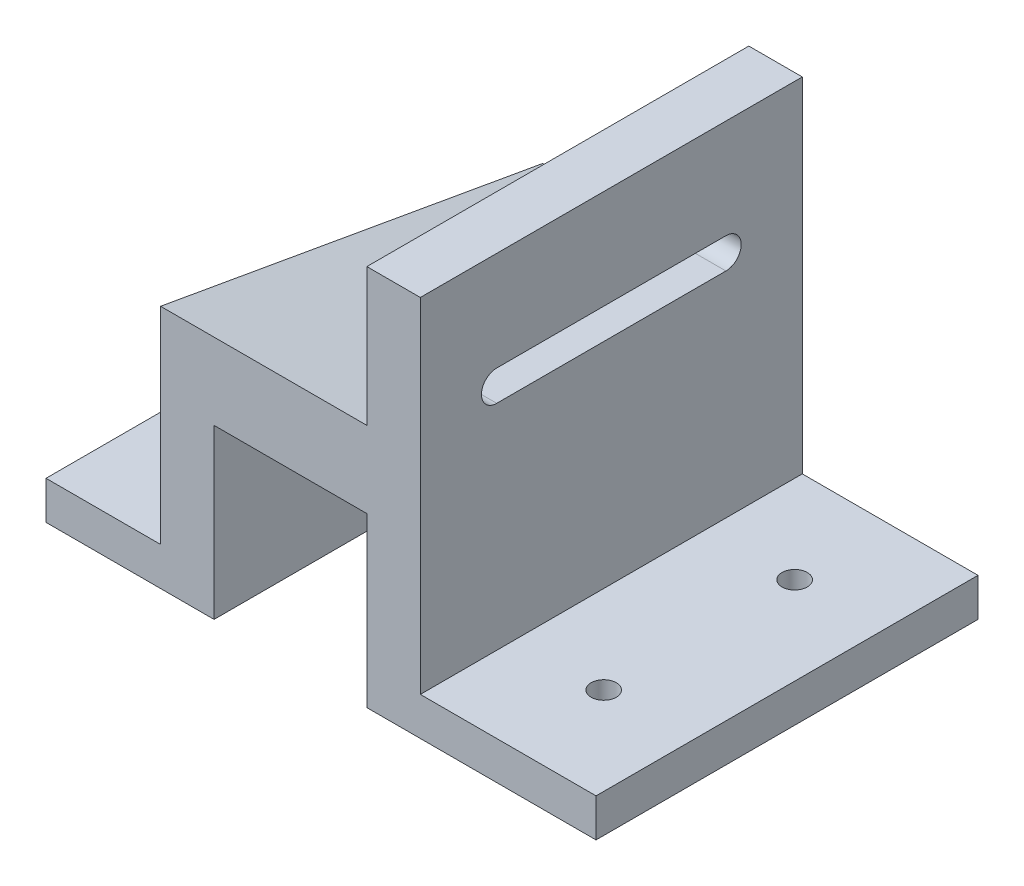
from build123d import *

# Parameters (mm, degrees)
RESSALTO_EXTRUS_O1_DEPTH = 50
CORTE_EXTRUS_O1_DEPTH    = 50
ESBO_O5_R                = 1.65
CORTE_EXTRUS_O2_DEPTH    = 10
ESBO_O7_W                = 27
ESBO_O7_H                = 9.386843201
ESBO_O7_W_2              = 20
ESBO_O7_H_2              = 15
CORTE_EXTRUS_O3_DEPTH    = 84.527706575
ESBO_O8_R                = 4.15
CORTE_EXTRUS_O4_DEPTH    = 77.677309979


with BuildPart() as part:
    # Esboço2 → Ressalto-extrusão1 (new body)
    with BuildSketch(Plane.XY):
        Polygon((0, 0), (30, 0), (30, 5), (7, 5), (7, 50), (0, 50), (0, 32), (-20, 32), (-27, 32), (-27, 5), (-42, 5), (-42, 0), (-20, 0), (-20, 7), (0, 7), align=None)
    extrude(amount=RESSALTO_EXTRUS_O1_DEPTH)

    # Esboço3 → Corte-extrusão1 (cut)
    with BuildSketch(Plane(origin=(7, 0, 0), x_dir=(0, 0, -1), z_dir=(1, 0, 0))):
        with BuildLine():
            Line((-40, 33), (-10, 33))
            ThreePointArc((-10, 33), (-8, 35), (-10, 37))
            Line((-10, 37), (-40, 37))
            ThreePointArc((-40, 37), (-42, 35), (-40, 33))
        make_face()
    extrude(amount=-CORTE_EXTRUS_O1_DEPTH, mode=Mode.SUBTRACT)

    # Esboço5 → Corte-extrusão2 (cut)
    with BuildSketch(Plane(origin=(0, 5, 0), x_dir=(1, 0, 0), z_dir=(0, 1, 0))):
        with Locations(Location((18.5, -37.5, 0), (0, 0, 180))):
            Circle(ESBO_O5_R)
        with Locations(Location((18.5, -12.5, 0), (0, 0, 180))):
            Circle(ESBO_O5_R)
        with Locations(Location((-34.5, -12.5, 0), (0, 0, 180))):
            Circle(ESBO_O5_R)
        with Locations(Location((-34.5, -37.5, 0), (0, 0, 180))):
            Circle(ESBO_O5_R)
    extrude(amount=-CORTE_EXTRUS_O2_DEPTH, mode=Mode.SUBTRACT)

    # Esboço7 → Corte-extrusão3 (cut, through all, along a direction that is not the sketch's normal)
    with BuildSketch(Plane.XY.offset(50)):
        with Locations((-13.5, 36.693421601)):
            Rectangle(ESBO_O7_W, ESBO_O7_H)
        with Locations((-10, 14.5)):
            Rectangle(ESBO_O7_W_2, ESBO_O7_H_2)
    extrude(amount=-CORTE_EXTRUS_O3_DEPTH, dir=(0, 0.1736481776669347, 0.9848077530122074), mode=Mode.SUBTRACT)

    # Esboço8 → Corte-extrusão4 (cut, through all)
    with BuildSketch(Plane(origin=(0, 12.786115246, -2.254537096), x_dir=(1, 0, 0), z_dir=(0, -0.9848077530122075, 0.1736481776669347))):
        with Locations(Location((-10, 27.674982262, 0), (0, 0, 270))):
            Circle(ESBO_O8_R)
    extrude(amount=-CORTE_EXTRUS_O4_DEPTH, mode=Mode.SUBTRACT)


solid = part.part
